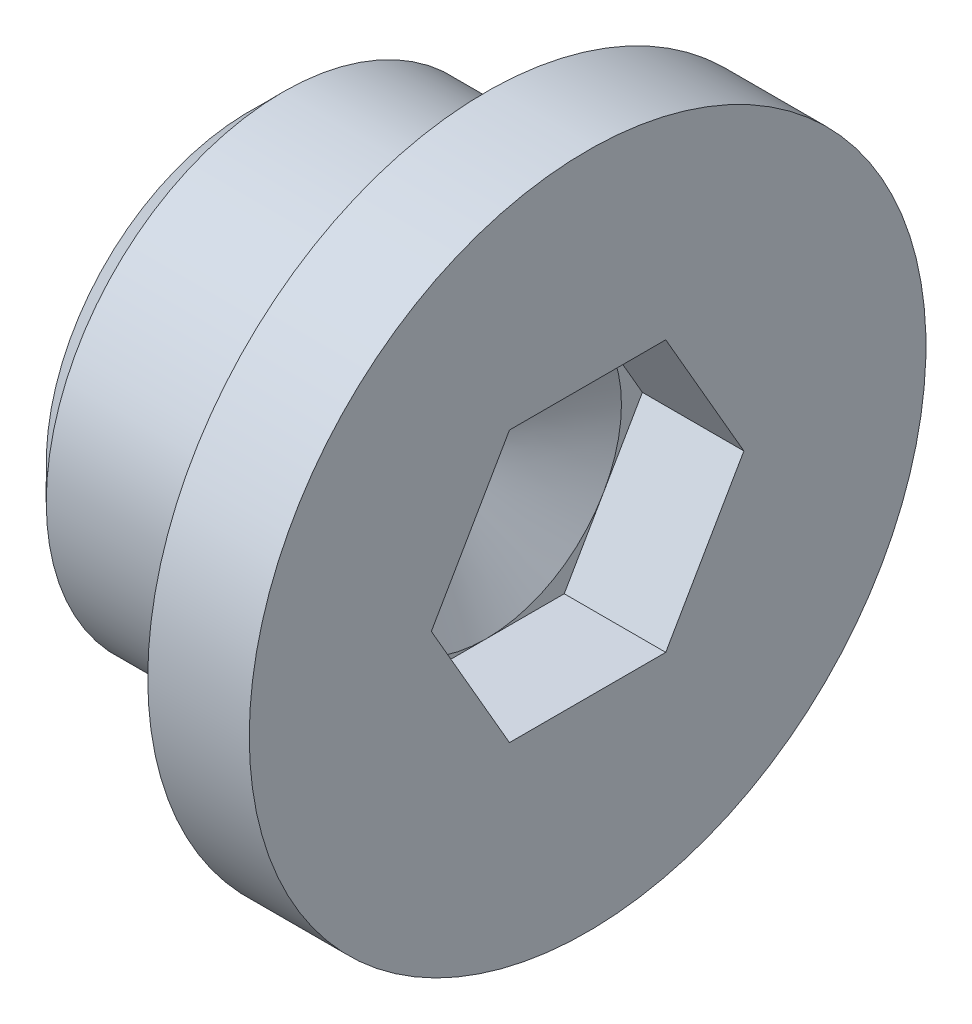
from build123d import *

# Parameters (mm, degrees)
ENL_V_MAT_EXTRU_1_DEPTH = 3
CHANFREIN1_SIZE         = 1


with BuildPart() as part:
    # Esquisse1 → Révolution1 (revolve)
    with BuildSketch(Plane.XY, mode=Mode.PRIVATE) as r_volution1_sk:
        with BuildLine():
            Line((0, 0), (0, 7))
            Line((0, 7), (5.983785808, 7))
            ThreePointArc((5.983785808, 7), (6.491892904, 6.491892904), (7, 7))
            Line((7, 7), (7, 10))
            Line((7, 10), (10, 10))
            Line((10, 10), (10, 0))
            Line((10, 0), (0, 0))
        make_face()
    revolve(r_volution1_sk.sketch.rotate(Axis((0, 0, 0), (1, 0, 0)), 90), axis=Axis((0, 0, 0), (1, 0, 0)))

    # Esquisse5 → Diamètre du perçage Ø8.0 (8)1 (revolve, cut)
    with BuildSketch(Plane(origin=(10, 0, 0), x_dir=(0, 0, -1), z_dir=(0, 1, 0))):
        Polygon((0, 0), (0, 5.403442476), (4, 3), (4, 0), align=None)
    revolve(axis=Axis((16.35, 0, 0), (-1, 0, 0)), mode=Mode.SUBTRACT)

    # Esquisse3 → Enlèv. mat.-Extru.1 (cut)
    with BuildSketch(Plane(origin=(10, 0, 0), x_dir=(0, 0, -1), z_dir=(1, 0, 0))):
        Polygon((-4.618802154, 0), (-2.309401077, 4), (2.309401077, 4), (4.618802154, 0), (2.309401077, -4), (-2.309401077, -4), align=None)
    extrude(amount=-ENL_V_MAT_EXTRU_1_DEPTH, mode=Mode.SUBTRACT)

    # Chanfrein1
    chanfrein1_edges = [part.edges().sort_by_distance(p)[0] for p in [
        (0, 0, -7),
    ]]
    chamfer(chanfrein1_edges, length=CHANFREIN1_SIZE)


solid = part.part
